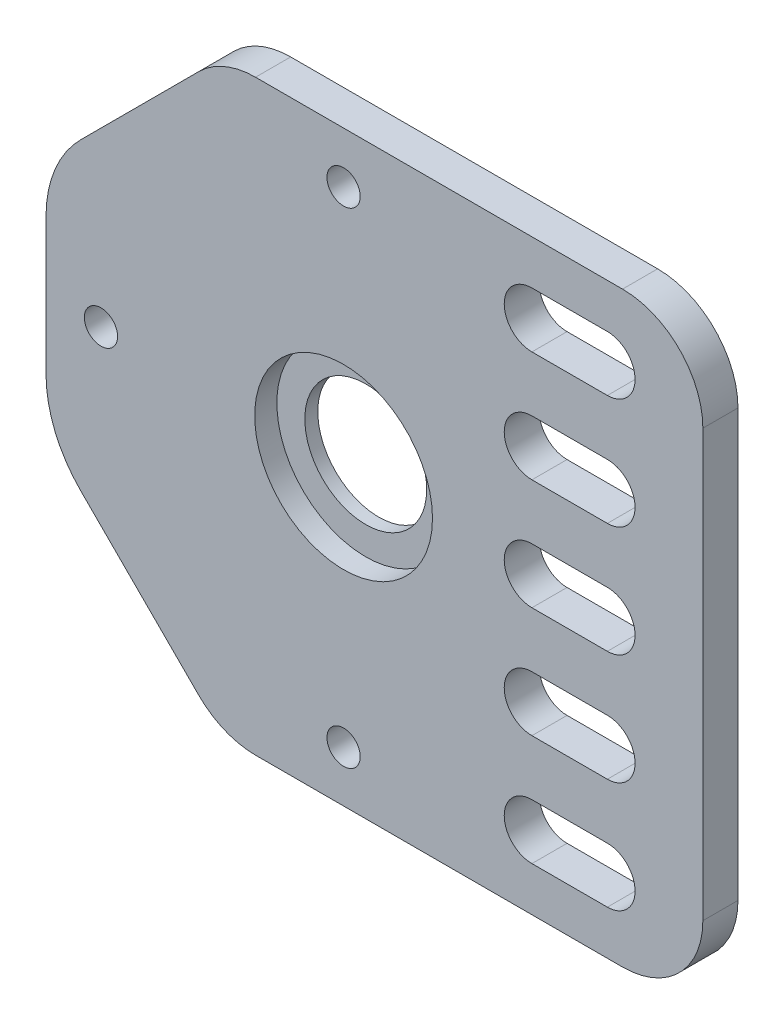
from build123d import *

# Parameters (mm, degrees)
SKETCH1_R           = 5.5
SKETCH1_R_2         = 1.5
BOSS_EXTRUDE1_DEPTH = 1.585
SKETCH3_R           = 8.025
CUT_EXTRUDE1_DEPTH  = 2


with BuildPart() as part:
    # Sketch1 → Boss-Extrude1 (new, symmetric)
    with BuildSketch(Plane.XY):
        with BuildLine():
            Line((25.18, -26.5), (-7.946951673, -26.5))
            ThreePointArc((-7.946951673, -26.5), (-10.721406557, -25.948126611), (-13.073475836, -24.376524164))
            Line((-13.073475836, -24.376524164), (-23.731900423, -13.718099577))
            ThreePointArc((-23.731900423, -13.718099577), (-26.047033407, -10.253258212), (-26.86, -6.166199154))
            Line((-26.86, -6.166199154), (-26.86, 6.166199154))
            ThreePointArc((-26.86, 6.166199154), (-26.047033407, 10.253258212), (-23.731900423, 13.718099577))
            Line((-23.731900423, 13.718099577), (-13.073475836, 24.376524164))
            ThreePointArc((-13.073475836, 24.376524164), (-10.721406557, 25.948126611), (-7.946951673, 26.5))
            Line((-7.946951673, 26.5), (25.18, 26.5))
            ThreePointArc((25.18, 26.5), (30.306524164, 24.376524164), (32.43, 19.25))
            Line((32.43, 19.25), (32.43, -19.25))
            ThreePointArc((32.43, -19.25), (30.306524164, -24.376524164), (25.18, -26.5))
        make_face()
        Circle(SKETCH1_R, mode=Mode.SUBTRACT)
        with Locations((0, 21.9)):
            Circle(SKETCH1_R_2, mode=Mode.SUBTRACT)
        with Locations((-21.9, 0)):
            Circle(SKETCH1_R_2, mode=Mode.SUBTRACT)
        with Locations((0, -21.9)):
            Circle(SKETCH1_R_2, mode=Mode.SUBTRACT)
        with BuildLine():
            Line((17, 22.5), (23.81, 22.5))
            ThreePointArc((23.81, 22.5), (26.31, 20), (23.81, 17.5))
            Line((23.81, 17.5), (17, 17.5))
            ThreePointArc((17, 17.5), (14.5, 20), (17, 22.5))
        make_face(mode=Mode.SUBTRACT)
        with BuildLine():
            Line((17, 12.5), (23.81, 12.5))
            ThreePointArc((23.81, 12.5), (26.31, 10), (23.81, 7.5))
            Line((23.81, 7.5), (17, 7.5))
            ThreePointArc((17, 7.5), (14.5, 10), (17, 12.5))
        make_face(mode=Mode.SUBTRACT)
        with BuildLine():
            Line((17, 2.5), (23.81, 2.5))
            ThreePointArc((23.81, 2.5), (26.31, 0), (23.81, -2.5))
            Line((23.81, -2.5), (17, -2.5))
            ThreePointArc((17, -2.5), (14.5, 0), (17, 2.5))
        make_face(mode=Mode.SUBTRACT)
        with BuildLine():
            Line((17, -7.5), (23.81, -7.5))
            ThreePointArc((23.81, -7.5), (26.31, -10), (23.81, -12.5))
            Line((23.81, -12.5), (17, -12.5))
            ThreePointArc((17, -12.5), (14.5, -10), (17, -7.5))
        make_face(mode=Mode.SUBTRACT)
        with BuildLine():
            Line((17, -17.5), (23.81, -17.5))
            ThreePointArc((23.81, -17.5), (26.31, -20), (23.81, -22.5))
            Line((23.81, -22.5), (17, -22.5))
            ThreePointArc((17, -22.5), (14.5, -20), (17, -17.5))
        make_face(mode=Mode.SUBTRACT)
    extrude(amount=BOSS_EXTRUDE1_DEPTH, both=True)

    # Sketch3 → Cut-Extrude1 (cut)
    with BuildSketch(Plane.XY.offset(1.585)):
        Circle(SKETCH3_R)
    extrude(amount=-CUT_EXTRUDE1_DEPTH, mode=Mode.SUBTRACT)


solid = part.part
